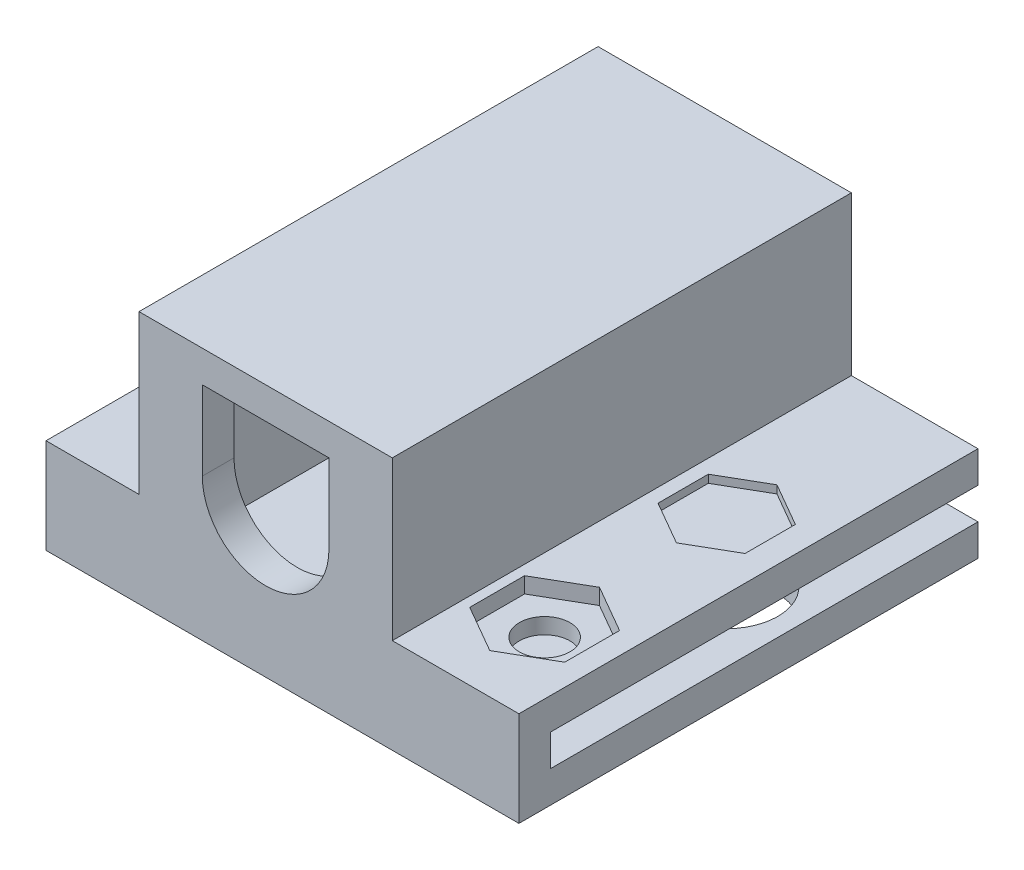
from build123d import *

# Parameters (mm, degrees)
EXTRUDE_1_DEPTH     = 2
EXTRUDE_2_DEPTH     = 27
SKETCH_4_R          = 3.227350269
CUT_EXTRUDE_1_DEPTH = 2
CUT_EXTRUDE_2_DEPTH = 0.5
CUT_EXTRUDE_3_DEPTH = 1
CUT_EXTRUDE_4_DEPTH = 34.256578297
SKETCH_8_W          = 12
SKETCH_8_H          = 1
EXTRUDE_3_DEPTH     = 1.6


with BuildPart() as part:
    # 草图1 → 凸台-拉伸1 (new body)
    with BuildSketch(Plane.XY):
        with BuildLine():
            Line((-5.5, -5), (5.5, -5))
            ThreePointArc((5.5, -5), (5.853553391, -4.853553391), (6, -4.5))
            Line((6, -4.5), (6, 4.5))
            ThreePointArc((6, 4.5), (5.853553391, 4.853553391), (5.5, 5))
            Line((5.5, 5), (4, 5))
            Line((4, 5), (4, 0))
            ThreePointArc((4, 0), (0, -4), (-4, 0))
            Line((-4, 0), (-4, 5))
            Line((-4, 5), (-5.5, 5))
            ThreePointArc((-5.5, 5), (-5.853553391, 4.853553391), (-6, 4.5))
            Line((-6, 4.5), (-6, -4.5))
            ThreePointArc((-6, -4.5), (-5.853553391, -4.853553391), (-5.5, -5))
        make_face()
        with BuildLine():
            Line((-8, -3), (-13.875, -3))
            Line((-13.875, -3), (-13.875, -9))
            Line((-13.875, -9), (16, -9))
            Line((16, -9), (16, -7))
            Line((16, -7), (-11.875, -7))
            Line((-11.875, -7), (-11.875, -5))
            Line((-11.875, -5), (-8, -5))
            Line((-8, -5), (-5.5, -5))
            ThreePointArc((-5.5, -5), (-5.853553391, -4.853553391), (-6, -4.5))
            Line((-6, -4.5), (-6, 4.5))
            ThreePointArc((-6, 4.5), (-5.853553391, 4.853553391), (-5.5, 5))
            Line((-5.5, 5), (-4, 5))
            Line((-4, 5), (4, 5))
            Line((4, 5), (5.5, 5))
            ThreePointArc((5.5, 5), (5.853553391, 4.853553391), (6, 4.5))
            Line((6, 4.5), (6, -4.5))
            ThreePointArc((6, -4.5), (5.853553391, -4.853553391), (5.5, -5))
            Line((5.5, -5), (8, -5))
            Line((8, -5), (16, -5))
            Line((16, -5), (16, -3))
            Line((16, -3), (8, -3))
            Line((8, -3), (8, 7))
            Line((8, 7), (-8, 7))
            Line((-8, 7), (-8, -3))
        make_face()
        Polygon((-11.875, -7), (16, -7), (16, -5), (8, -5), (5.5, -5), (-5.5, -5), (-8, -5), (-11.875, -5), align=None)
    extrude(amount=EXTRUDE_1_DEPTH)

    # 草图2 → 凸台-拉伸2 (add)
    with BuildSketch(Plane(origin=(0, 0, 0), x_dir=(-1, 0, 0), z_dir=(0, 0, -1))):
        Polygon((-6, 4.5), (-6, 5), (-5.5, 5), (5.5, 5), (6, 5), (6, 4.5), (6, -4.5), (6, -5), (11.875, -5), (11.875, -7), (-16, -7), (-16, -9), (13.875, -9), (13.875, -3), (8, -3), (8, 7), (-8, 7), (-8, -3), (-16, -3), (-16, -5), (-6, -5), (-6, -4.5), align=None)
    extrude(amount=EXTRUDE_2_DEPTH)

    # 草图4 → 切除-拉伸1 (cut)
    with BuildSketch(Plane.XZ.offset(9)):
        with Locations(Location((11.625, -15.5, 0), (0, 0, 270))):
            Circle(SKETCH_4_R)
    extrude(amount=-CUT_EXTRUDE_1_DEPTH, mode=Mode.SUBTRACT)

    # 草图5 → 切除-拉伸2 (cut)
    with BuildSketch(Plane(origin=(0, -3, 0), x_dir=(1, 0, 0), z_dir=(0, 1, 0))):
        Polygon((11.625, 18.675426481), (8.875, 17.08771324), (8.875, 13.91228676), (11.625, 12.324573519), (14.375, 13.91228676), (14.375, 17.08771324), align=None)
    extrude(amount=-CUT_EXTRUDE_2_DEPTH, mode=Mode.SUBTRACT)

    # 草图6 → 切除-拉伸3 (cut)
    with BuildSketch(Plane(origin=(0, -3, 0), x_dir=(1, 0, 0), z_dir=(0, 1, 0))):
        Polygon((8.625, 2.267949192), (11.625, 0.535898385), (14.625, 2.267949192), (14.625, 5.732050808), (11.625, 7.464101615), (8.625, 5.732050808), align=None)
    extrude(amount=-CUT_EXTRUDE_3_DEPTH, mode=Mode.SUBTRACT)

    # 草图7 → 切除-拉伸4 (cut, through all)
    with BuildSketch(Plane(origin=(0, -4, 0), x_dir=(1, 0, 0), z_dir=(0, 1, 0))):
        with BuildLine():
            ThreePointArc((13.225, 4), (12.75637085, 5.13137085), (11.625, 5.6))
            Line((11.625, 5.6), (11.625, 2.4))
            ThreePointArc((11.625, 2.4), (12.75637085, 2.86862915), (13.225, 4))
        make_face()
        with BuildLine():
            Line((11.625, 2.4), (11.625, 5.6))
            ThreePointArc((11.625, 5.6), (10.025, 4), (11.625, 2.4))
        make_face()
    extrude(amount=-CUT_EXTRUDE_4_DEPTH, mode=Mode.SUBTRACT)

    # 草图8 → 凸台-拉伸3 (add)
    with BuildSketch(Plane(origin=(0, 0, -27), x_dir=(-1, 0, 0), z_dir=(0, 0, -1))):
        with Locations((0, 4.5)):
            Rectangle(SKETCH_8_W, SKETCH_8_H)
    extrude(amount=-EXTRUDE_3_DEPTH)


solid = part.part
